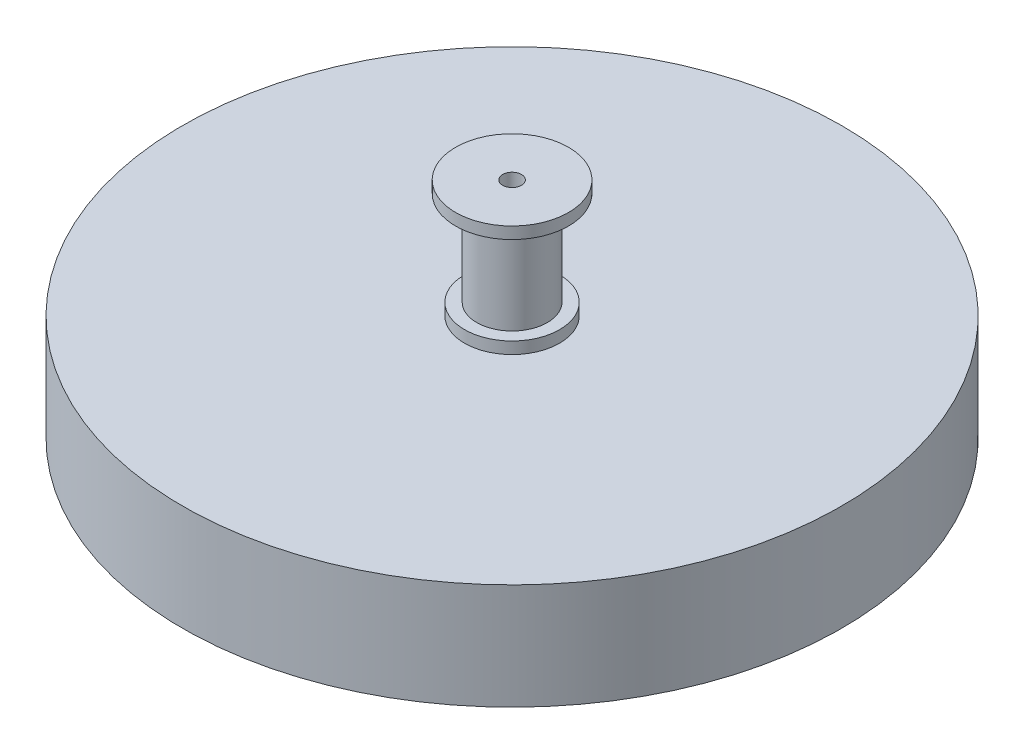
from build123d import *


with BuildPart() as part:
    # Sketch1 → Revolve1 (revolve)
    with BuildSketch(Plane(origin=(0, 0, 0), x_dir=(0, 0, -1), z_dir=(1, 0, 0)), mode=Mode.PRIVATE) as revolve1_sk:
        Polygon((-24, 72.5), (-24, 67.5), (-15, 67.5), (-15, 27.5), (-20.190476188, 27.5), (-20.190476188, 22.5), (-140, 22.5), (-140, -22.5), (-20.190476188, -22.5), (-20.190476188, -27.5), (-15, -27.5), (-15, -67.5), (-24, -67.5), (-24, -72.5), (-4, -72.5), (-4, -32.5), (-4, 72.5), align=None)
    revolve(revolve1_sk.sketch.rotate(Axis((0, -1004.712608179, 0), (0, 1, 0)), 180), axis=Axis((0, -1004.712608179, 0), (0, 1, 0)))


solid = part.part
